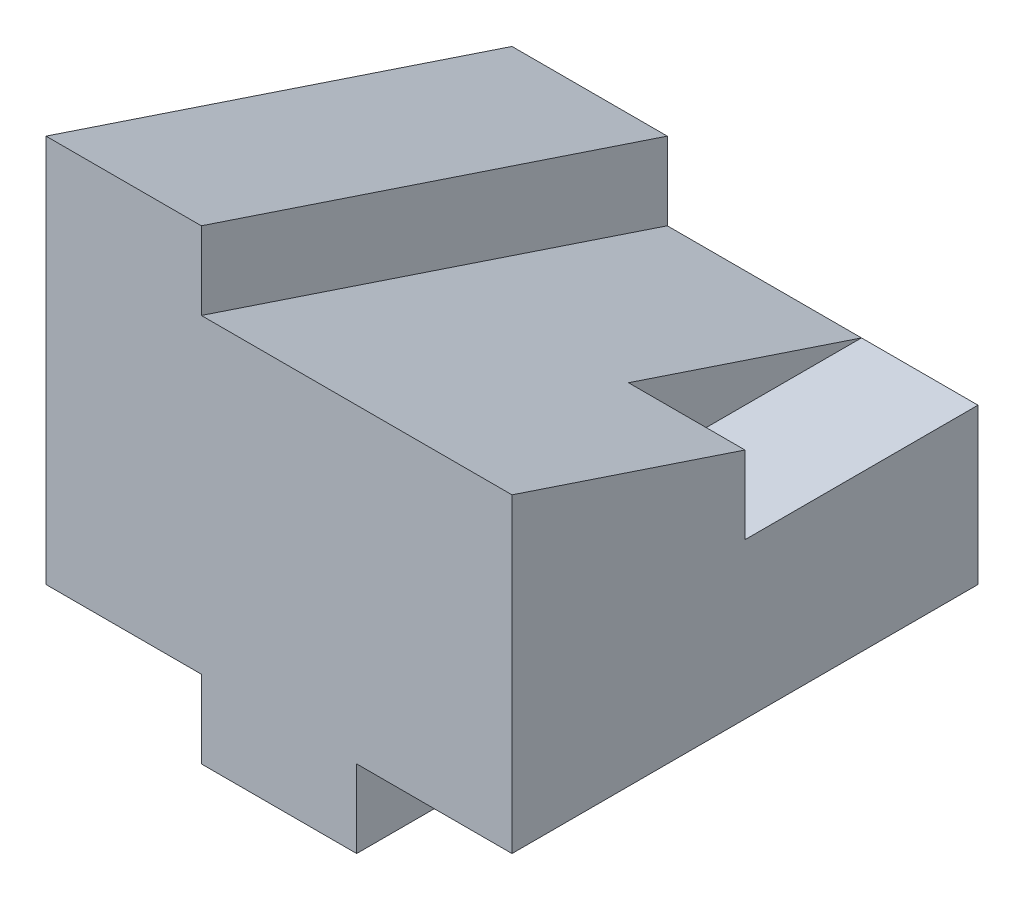
from build123d import *

# Parameters (mm, degrees)
BOSS_EXTRUDE7_DEPTH  = 25
SKETCH1_12_W         = 60
SKETCH1_12_H         = 10
BOSS_EXTRUDE8_DEPTH  = 20
BOSS_EXTRUDE9_DEPTH  = 40
BOSS_EXTRUDE10_DEPTH = 20


with BuildPart() as part:
    # Sketch1 → Boss-Extrude7 (new body)
    with BuildSketch(Plane(origin=(0, 0, 0), x_dir=(0, 0, -1), z_dir=(1, 0, 0))):
        Polygon((60, 20), (30, 30), (30, 20), align=None)
    extrude(amount=BOSS_EXTRUDE7_DEPTH)



with BuildPart() as body_2:
    # Sketch1<12> → Boss-Extrude8 (new body)
    with BuildSketch(Plane(origin=(0, 0, 0), x_dir=(0, 0, -1), z_dir=(1, 0, 0))):
        with Locations((30, -5)):
            Rectangle(SKETCH1_12_W, SKETCH1_12_H)
    extrude(amount=BOSS_EXTRUDE8_DEPTH)


with BuildPart() as part_1:
    add(part.part)

    add(body_2.part)  # Boss-Extrude9 merges body 2
    # Sketch1<13> → Boss-Extrude9 (add)
    with BuildSketch(Plane(origin=(0, 0, 0), x_dir=(0, 0, -1), z_dir=(1, 0, 0))):
        Polygon((30, 30), (0, 40), (0, 0), (60, 0), (60, 20), (30, 20), align=None)
    extrude(amount=BOSS_EXTRUDE9_DEPTH)

    # Sketch1<14> → Boss-Extrude10 (add)
    with BuildSketch(Plane(origin=(0, 0, 0), x_dir=(0, 0, -1), z_dir=(1, 0, 0))):
        Polygon((60, 0), (60, 30), (0, 50), (0, 0), align=None)
    extrude(amount=-BOSS_EXTRUDE10_DEPTH)


solid = part_1.part
